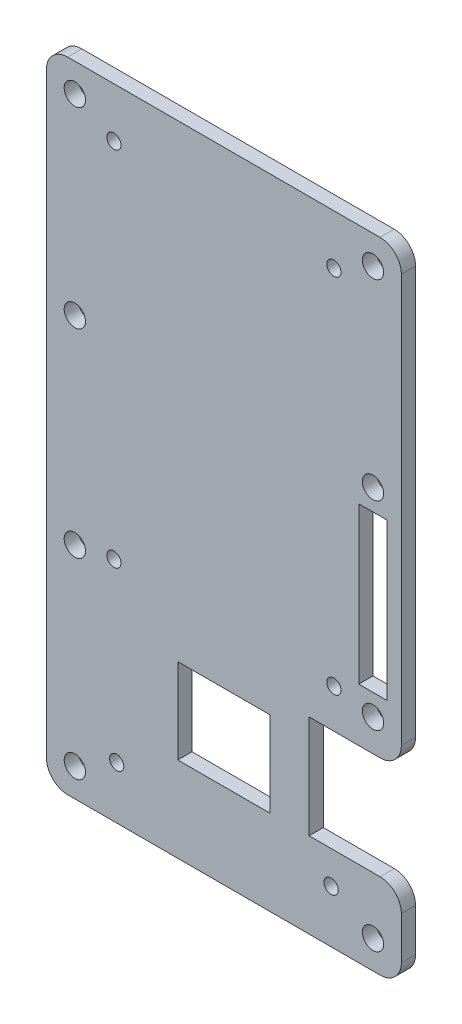
from build123d import *

# Parameters (mm, degrees)
SKETCH_1_R          = 1.00000054
SKETCH_1_W          = 13
SKETCH_1_H          = 12
SKETCH_1_W_2        = 35.054000855
SKETCH_1_H_2        = 47
SKETCH_1_W_3        = 4
SKETCH_1_H_3        = 22
EXTRUDE_1_DEPTH     = 2
FILLET_2_R          = 3
SKETCH_2_R          = 1.5
CUT_EXTRUDE_1_DEPTH = 120.290710997


with BuildPart() as part:
    # 草图1 → 凸台-拉伸1 (new body)
    # profile 1 of 2: a face of its own
    with BuildSketch(Plane.XY.offset(11.133645354)):
        Polygon((86.391138075, 82.236518604), (36.391138075, 82.236518604), (36.391138075, -7.763481396), (86.391138075, -7.763481396), (86.391138075, 4.236518604), (73.391138075, 4.236518604), (73.391138075, 18.736518604), (86.391138075, 18.736518604), align=None)
        with Locations((46.291138075, -0.363481396)):
            Circle(SKETCH_1_R, mode=Mode.SUBTRACT)
        with Locations((45.891138075, 24.236518604)):
            Circle(SKETCH_1_R, mode=Mode.SUBTRACT)
        with Locations((61.391138075, 10.236518604)):
            Rectangle(SKETCH_1_W, SKETCH_1_H, mode=Mode.SUBTRACT)
        with Locations((76.491138075, -0.363481396)):
            Circle(SKETCH_1_R, mode=Mode.SUBTRACT)
        with Locations((76.891138075, 24.236518604)):
            Circle(SKETCH_1_R, mode=Mode.SUBTRACT)
        with Locations((61.385138076, 49.650651887)):
            Rectangle(SKETCH_1_W_2, SKETCH_1_H_2, mode=Mode.SUBTRACT)
        with Locations((45.891138075, 75.236518604)):
            Circle(SKETCH_1_R, mode=Mode.SUBTRACT)
        with Locations((82.391138075, 37.236518604)):
            Rectangle(SKETCH_1_W_3, SKETCH_1_H_3, mode=Mode.SUBTRACT)
        with Locations((76.891138075, 75.236518604)):
            Circle(SKETCH_1_R, mode=Mode.SUBTRACT)
    # profile 2 of 2: a face of its own
    with BuildSketch(Plane.XY.offset(11.133645354)):
        with Locations((61.385138076, 49.650651887)):
            Rectangle(SKETCH_1_W_2, SKETCH_1_H_2)
    extrude(amount=EXTRUDE_1_DEPTH)

    # 圆角2
    fillet_2_edges = [part.edges().sort_by_distance(p)[0] for p in [
        (86.391138075, 4.236518604, 12.133645354),
        (86.391138075, -7.763481396, 12.133645354),
        (36.391138075, -7.763481396, 12.133645354),
        (36.391138075, 82.236518604, 12.133645354),
        (86.391138075, 82.236518604, 12.133645354),
        (86.391138075, 18.736518604, 12.133645354),
    ]]
    fillet(fillet_2_edges, radius=FILLET_2_R)

    # 草图2 → 切除-拉伸1 (cut, through all)
    with BuildSketch(Plane.XY.offset(13.133645354)):
        with Locations((40.391138075, 78.236518604)):
            Circle(SKETCH_2_R)
        with Locations(Location((82.391138075, 78.236518604, 0), (0, 0, 180))):
            Circle(SKETCH_2_R)
        with Locations((40.391138075, 23.236518604)):
            Circle(SKETCH_2_R)
        with Locations(Location((82.391138075, 23.236518604, 0), (0, 0, 180))):
            Circle(SKETCH_2_R)
        with Locations(Location((40.391138075, 51.236518604, 0), (0, 0, 180))):
            Circle(SKETCH_2_R)
        with Locations((82.391138075, 51.236518604)):
            Circle(SKETCH_2_R)
        with Locations((82.391138075, -3.763481396)):
            Circle(SKETCH_2_R)
        with Locations(Location((40.391138075, -3.763481396, 0), (0, 0, 180))):
            Circle(SKETCH_2_R)
    extrude(amount=-CUT_EXTRUDE_1_DEPTH, mode=Mode.SUBTRACT)


solid = part.part
